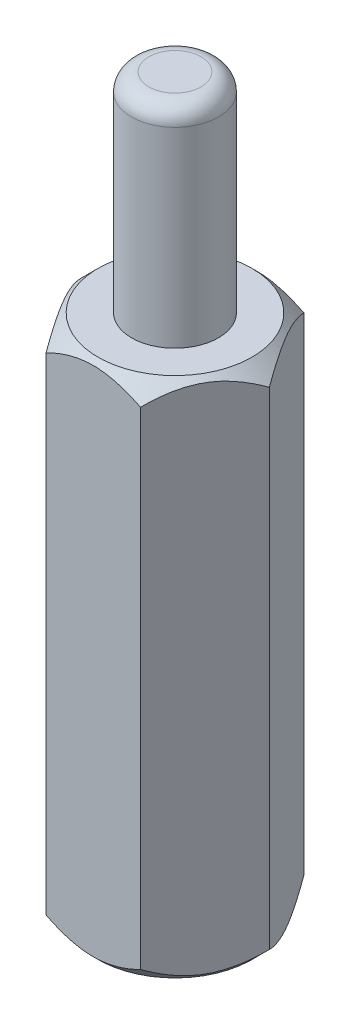
from build123d import *

# Parameters (mm, degrees)
EXTRUDE_1_DEPTH     = 15
SKETCH_2_R          = 1.25
CUT_EXTRUDE_1_DEPTH = 10
SKETCH_4_R          = 1.25
EXTRUDE_2_DEPTH     = 6
FILLET_1_R          = 0.5


with BuildPart() as part:
    # 草图1 → 凸台-拉伸1 (new body)
    with BuildSketch(Plane(origin=(0, 0, 0), x_dir=(1, 0, 0), z_dir=(0, 1, 0))):
        Polygon((2.713546265, 0), (1.356773133, 2.35), (-1.356773133, 2.35), (-2.713546265, 0), (-1.356773133, -2.35), (1.356773133, -2.35), align=None)
    extrude(amount=EXTRUDE_1_DEPTH)

    # 草图2 → 切除-拉伸1 (cut)
    with BuildSketch(Plane.XZ):
        with Locations(Location((0, 0, 0), (0, 0, 270))):
            Circle(SKETCH_2_R)
    extrude(amount=-CUT_EXTRUDE_1_DEPTH, mode=Mode.SUBTRACT)

    # 草图7 → 切除-旋转4 (revolve, cut)
    with BuildSketch(Plane.XY, mode=Mode.PRIVATE) as cut_revolve_4_sk:
        Polygon((-2.713546265, 15), (-2.713546265, 14.5), (-2.213546265, 15), align=None)
    cut_revolve_4 = revolve(cut_revolve_4_sk.sketch.rotate(Axis((0, 0, 0), (0, 1, 0)), 270), axis=Axis((0, 0, 0), (0, 1, 0)), mode=Mode.SUBTRACT)

    # 镜向1: 切除-旋转4 across plane
    add(cut_revolve_4.mirror(Plane(origin=(0, 7.5, 0), x_dir=(0, 0, 1), z_dir=(0, -1, 0))), mode=Mode.SUBTRACT)


with BuildPart() as body_2:
    # 草图4 → 凸台-拉伸2 (new body)
    with BuildSketch(Plane(origin=(0, 15, 0), x_dir=(1, 0, 0), z_dir=(0, 1, 0))):
        with Locations(Location((0, 0, 0), (0, 0, 270))):
            Circle(SKETCH_4_R)
    extrude(amount=EXTRUDE_2_DEPTH)

    # 圆角1
    fillet_1_edges = [body_2.edges().sort_by_distance(p)[0] for p in [
        (0, 21, -1.25),
    ]]
    fillet(fillet_1_edges, radius=FILLET_1_R)


solid = Compound([part.part, body_2.part])
